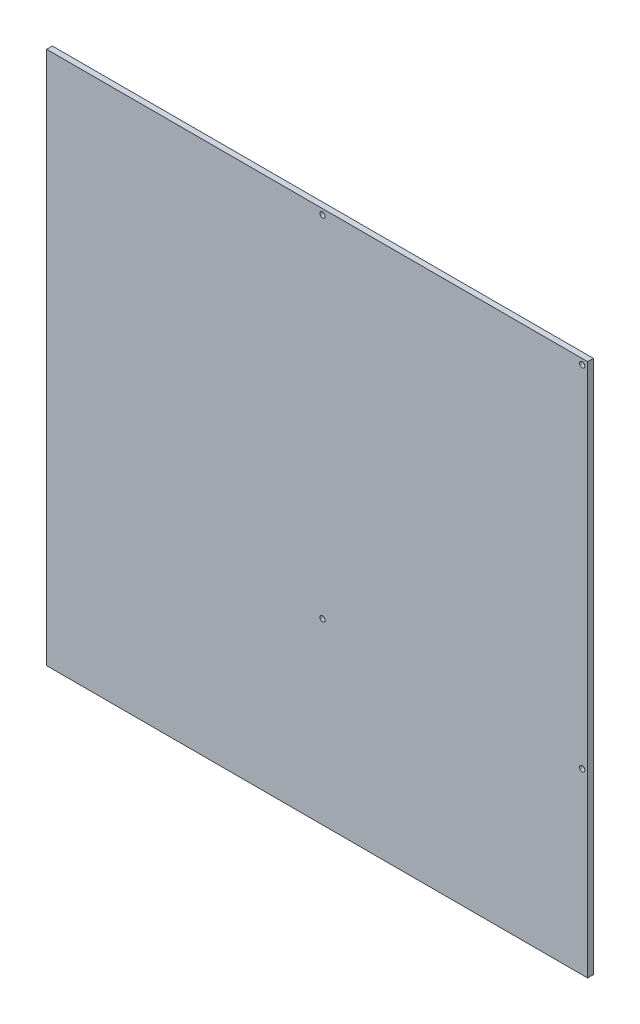
from build123d import *

# Parameters (mm, degrees)
SKETCH1_W           = 300
SKETCH1_H           = 296
BOSS_EXTRUDE1_DEPTH = 3.18
SKETCH2_R           = 1.47
CUT_EXTRUDE1_DEPTH  = 3.18


with BuildPart() as part:
    # Sketch1 → Boss-Extrude1 (new body)
    with BuildSketch(Plane.XY):
        Rectangle(SKETCH1_W, SKETCH1_H)
    extrude(amount=BOSS_EXTRUDE1_DEPTH)

    # Sketch2 → Cut-Extrude1 (cut)
    with BuildSketch(Plane.XY.offset(3.18)):
        with Locations((147, 145)):
            Circle(SKETCH2_R)
        with Locations((147, -49)):
            Circle(SKETCH2_R)
        with Locations((3, -49)):
            Circle(SKETCH2_R)
        with Locations((3, 145)):
            Circle(SKETCH2_R)
    extrude(amount=-CUT_EXTRUDE1_DEPTH, mode=Mode.SUBTRACT)


solid = part.part
